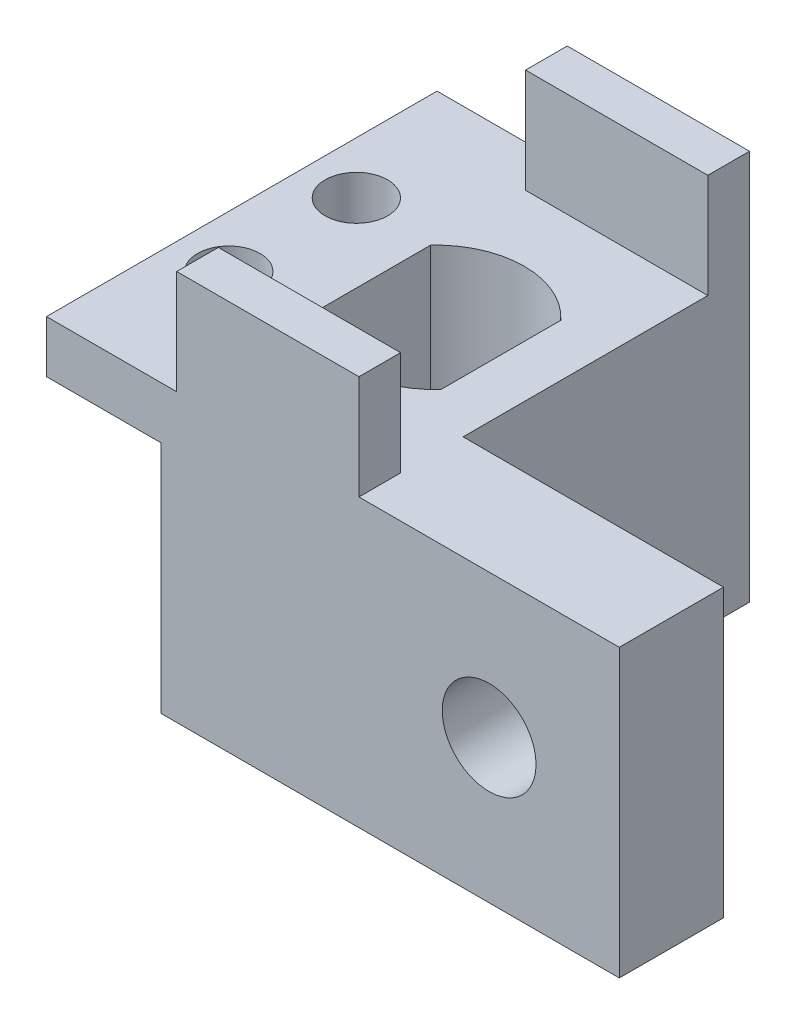
from build123d import *

# Parameters (mm, degrees)
BOSS_EXTRUDE1_DEPTH = 2.54
CUT_EXTRUDE1_DEPTH  = 23.876
SKETCH3_R           = 1.524
CUT_EXTRUDE2_DEPTH  = 2.54
SKETCH4_W           = 8.89
SKETCH4_H           = 2.032
BOSS_EXTRUDE2_DEPTH = 5.08
SKETCH5_W           = 12.7
SKETCH5_H           = 5.08
BOSS_EXTRUDE3_DEPTH = 11.43
SKETCH6_R           = 2.286
CUT_EXTRUDE3_DEPTH  = 11.43
SKETCH7_W           = 9.652
SKETCH7_H           = 19.05
BOSS_EXTRUDE4_DEPTH = 11.43
CUT_EXTRUDE4_DEPTH  = 25.4


with BuildPart() as part:
    # Sketch1 → Boss-Extrude1 (new body)
    with BuildSketch(Plane(origin=(0, 0, 0), x_dir=(1, 0, 0), z_dir=(0, 1, 0))):
        Polygon((0, 0), (12.7, 0), (12.7, -5.08), (-15.24, -5.08), (-15.24, 13.97), (0, 13.97), align=None)
    extrude(amount=BOSS_EXTRUDE1_DEPTH)

    # Sketch2 → Cut-Extrude1 (cut)
    with BuildSketch(Plane(origin=(0, 2.54, 0), x_dir=(1, 0, 0), z_dir=(0, 1, 0))):
        with BuildLine():
            Line((-8.89, 1.45498347), (-8.89, 7.30801653))
            ThreePointArc((-8.89, 7.30801653), (-5.715, 8.6995), (-2.54, 7.30801653))
            Line((-2.54, 7.30801653), (-2.54, 1.45498347))
            ThreePointArc((-2.54, 1.45498347), (-5.715, 0.0635), (-8.89, 1.45498347))
        make_face()
    extrude(amount=-CUT_EXTRUDE1_DEPTH, mode=Mode.SUBTRACT)

    # Sketch3 → Cut-Extrude2 (cut)
    with BuildSketch(Plane(origin=(0, 2.54, 0), x_dir=(1, 0, 0), z_dir=(0, 1, 0))):
        with Locations((-12.7, 1.27)):
            Circle(SKETCH3_R)
        with Locations((-12.7, 7.493)):
            Circle(SKETCH3_R)
    extrude(amount=-CUT_EXTRUDE2_DEPTH, mode=Mode.SUBTRACT)

    # Sketch4 → Boss-Extrude2 (add)
    with BuildSketch(Plane(origin=(0, 2.54, 0), x_dir=(1, 0, 0), z_dir=(0, 1, 0))):
        with Locations((-4.445, 12.954)):
            Rectangle(SKETCH4_W, SKETCH4_H)
        with Locations((-4.445, -4.064)):
            Rectangle(SKETCH4_W, SKETCH4_H)
    extrude(amount=BOSS_EXTRUDE2_DEPTH)

    # Sketch5 → Boss-Extrude3 (add)
    with BuildSketch(Plane.XZ):
        with Locations((6.35, 2.54)):
            Rectangle(SKETCH5_W, SKETCH5_H)
    extrude(amount=BOSS_EXTRUDE3_DEPTH)

    # Sketch6 → Cut-Extrude3 (cut)
    with BuildSketch(Plane(origin=(0, 0, 0), x_dir=(-1, 0, 0), z_dir=(0, 0, -1))):
        with Locations((-6.35, -4.445)):
            Circle(SKETCH6_R)
    extrude(amount=-CUT_EXTRUDE3_DEPTH, mode=Mode.SUBTRACT)

    # Sketch7 → Boss-Extrude4 (add)
    with BuildSketch(Plane.XZ):
        with Locations((-4.826, -4.445)):
            Rectangle(SKETCH7_W, SKETCH7_H)
    extrude(amount=BOSS_EXTRUDE4_DEPTH)

    # Sketch2<3> → Cut-Extrude4 (cut)
    with BuildSketch(Plane(origin=(0, 2.54, 0), x_dir=(1, 0, 0), z_dir=(0, 1, 0))):
        with BuildLine():
            Line((-8.89, 1.45498347), (-8.89, 7.30801653))
            ThreePointArc((-8.89, 7.30801653), (-5.715, 8.6995), (-2.54, 7.30801653))
            Line((-2.54, 7.30801653), (-2.54, 1.45498347))
            ThreePointArc((-2.54, 1.45498347), (-5.715, 0.0635), (-8.89, 1.45498347))
        make_face()
    extrude(amount=-CUT_EXTRUDE4_DEPTH, mode=Mode.SUBTRACT)


solid = part.part
